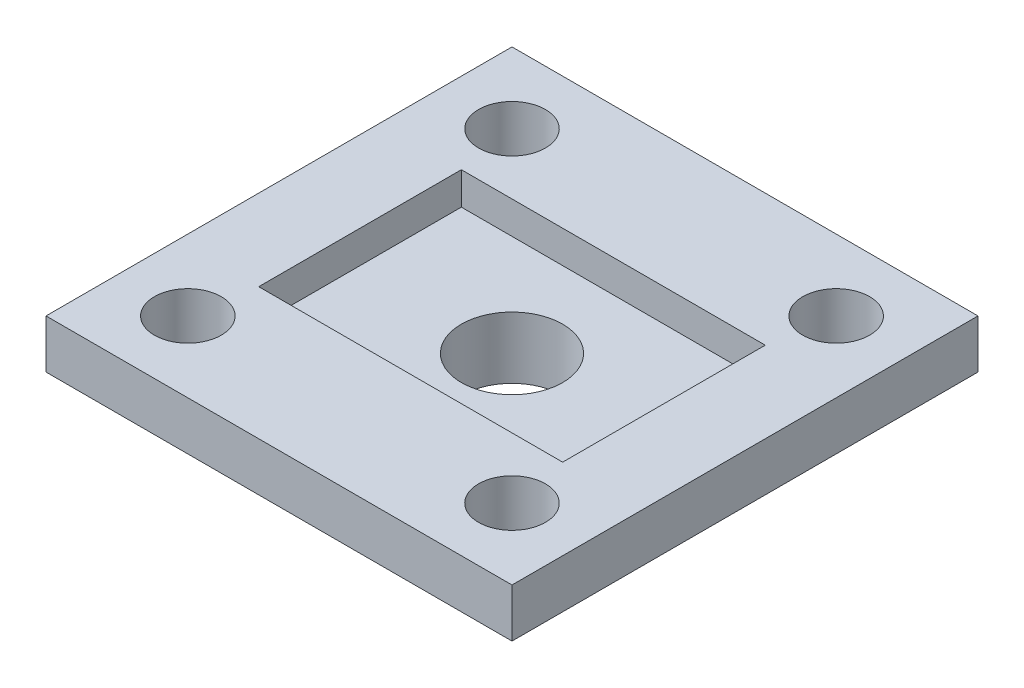
from build123d import *
from build123d.topology import SkipClean

# Parameters (mm, degrees)
SKETCH1_W           = 23
SKETCH1_H           = 23
SKETCH1_R           = 1.65
BOSS_EXTRUDE1_DEPTH = 2.4
CUT_EXTRUDE1_REACH  = 18.44
SKETCH2_R           = 2.5
SKETCH3_W           = 15
SKETCH3_H           = 10
CUT_EXTRUDE2_DEPTH  = 1.6
SKETCH4_R           = 3.5
SKETCH4_R_2         = 2.5
BOSS_EXTRUDE2_DEPTH = 2.25


with BuildPart() as part:
    # Sketch1 → Boss-Extrude1 (new body)
    with BuildSketch(Plane(origin=(0, 0, 0), x_dir=(1, 0, 0), z_dir=(0, 1, 0))):
        Rectangle(SKETCH1_W, SKETCH1_H)
        with Locations(Location((-8, 8, 0), (0, 0, 270))):
            Circle(SKETCH1_R, mode=Mode.SUBTRACT)
        with Locations(Location((8, -8, 0), (0, 0, 90))):
            Circle(SKETCH1_R, mode=Mode.SUBTRACT)
        with Locations(Location((-8, -8, 0), (0, 0, 270))):
            Circle(SKETCH1_R, mode=Mode.SUBTRACT)
        with Locations(Location((8, 8, 0), (0, 0, 90))):
            Circle(SKETCH1_R, mode=Mode.SUBTRACT)
    extrude(amount=BOSS_EXTRUDE1_DEPTH)

    # Sketch2 → Cut-Extrude1 (cut, up to next)
    with BuildSketch(Plane(origin=(0, 2.4, 0), x_dir=(1, 0, 0), z_dir=(0, 1, 0)), mode=Mode.PRIVATE) as cut_extrude1_sk1:
        with Locations(Location((0, 0, 0), (0, 0, 270))):
            Circle(SKETCH2_R)
    cut_extrude1_tool1 = extrude(cut_extrude1_sk1.sketch, amount=-CUT_EXTRUDE1_REACH, mode=Mode.PRIVATE) & part.part
    add(cut_extrude1_tool1.solids().sort_by_distance((0, 2.4, 0))[0], mode=Mode.SUBTRACT)

    # Sketch3 → Cut-Extrude2 (cut)
    with BuildSketch(Plane(origin=(0, 2.4, 0), x_dir=(1, 0, 0), z_dir=(0, 1, 0))):
        Rectangle(SKETCH3_W, SKETCH3_H)
    extrude(amount=-CUT_EXTRUDE2_DEPTH, mode=Mode.SUBTRACT)

    # Sketch4 → Boss-Extrude2 (add)
    with SkipClean():  # the faces are left unmerged after this step: merging them gives an invalid solid
        with BuildSketch(Plane.XZ):
            with Locations(Location((0, 0, 0), (0, 0, 270))):
                Circle(SKETCH4_R)
            with Locations(Location((0, 0, 0), (0, 0, 270))):
                Circle(SKETCH4_R_2, mode=Mode.SUBTRACT)
        extrude(amount=BOSS_EXTRUDE2_DEPTH)


solid = part.part
